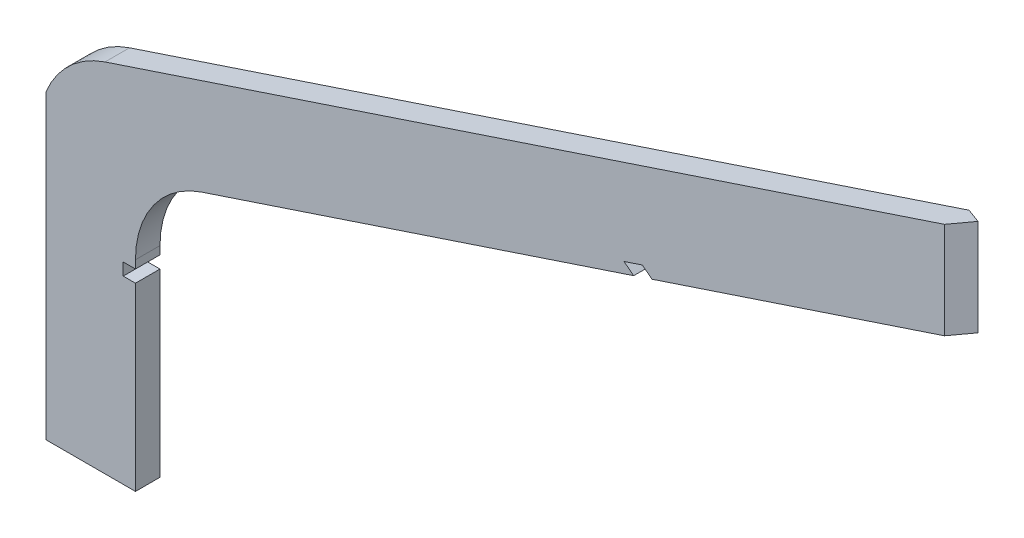
from build123d import *

# Parameters (mm, degrees)
BOSS_EXTRUDE1_DEPTH      = 3.175
BOSS_EXTRUDE1_DEPTH_BACK = 3.175
CUT_EXTRUDE3_DEPTH       = 206.528461822
CUT_EXTRUDE5_DEPTH       = 206.528461822
CUT_EXTRUDE6_DEPTH       = 6.35
SKETCH8_W                = 3.175
SKETCH8_H                = 3.175
CUT_EXTRUDE7_DEPTH       = 6.35


with BuildPart() as part:
    # Sketch1 → Boss-Extrude1 (new, two sides: drawn at the far end of the back side and taken through both)
    with BuildSketch(Plane.XY.offset(-BOSS_EXTRUDE1_DEPTH_BACK)):
        with BuildLine():
            Line((-95.480291898, -80.706386575), (-95.480291898, -131.085242165))
            Line((-95.480291898, -131.085242165), (-95.480291898, -132.672742165))
            Line((-95.480291898, -132.672742165), (-120.480291898, -132.672742165))
            Line((-120.480291898, -132.672742165), (-120.480291898, -131.085242165))
            Line((-120.480291898, -131.085242165), (-120.480291898, -64.018285781))
            ThreePointArc((-120.480291898, -64.018285781), (-115.755703828, -49.392703021), (-103.367678212, -40.295108567))
            Line((-103.367678212, -40.295108567), (119.519708102, 33.809591006))
            Line((119.519708102, 33.809591006), (119.519708102, 8.809591006))
            Line((119.519708102, 8.809591006), (-78.367678212, -56.983209361))
            ThreePointArc((-78.367678212, -56.983209361), (-90.755703828, -66.080803815), (-95.480291898, -80.706386575))
        make_face()
    extrude(amount=BOSS_EXTRUDE1_DEPTH + BOSS_EXTRUDE1_DEPTH_BACK)

    # Sketch2 → Cut-Extrude3 (cut, through all)
    with BuildSketch(Plane.XZ.offset(132.672742165)):
        Polygon((-120.480291898, 0), (-120.480291898, 3.175), (-118.647204793, 3.175), align=None)
    cut_extrude3 = extrude(amount=-CUT_EXTRUDE3_DEPTH, mode=Mode.SUBTRACT)

    # Mirror3: Cut-Extrude3 across plane
    add(cut_extrude3.mirror(Plane.XY), mode=Mode.SUBTRACT)

    # Sketch3 → Cut-Extrude5 (cut, through all)
    with BuildSketch(Plane.XZ.offset(132.672742165)):
        Polygon((119.519708102, 3.175), (114.020446788, 3.175), (119.519708102, 0), align=None)
    cut_extrude5 = extrude(amount=-CUT_EXTRUDE5_DEPTH, mode=Mode.SUBTRACT)

    # Mirror4: Cut-Extrude5 across plane
    add(cut_extrude5.mirror(Plane.XY), mode=Mode.SUBTRACT)

    # Sketch6 → Cut-Extrude6 (cut)
    with BuildSketch(Plane.XY.offset(3.175)):
        Polygon((33.546459297, -19.774448133), (38.29109474, -18.19697087), (35.769730347, -16.267373348), (31.025094904, -17.844850611), align=None)
    extrude(amount=-CUT_EXTRUDE6_DEPTH, mode=Mode.SUBTRACT)

    # Sketch8 → Cut-Extrude7 (cut)
    with BuildSketch(Plane.XY.offset(3.175)):
        with Locations((-97.067791898, -84.378992165)):
            Rectangle(SKETCH8_W, SKETCH8_H)
    extrude(amount=-CUT_EXTRUDE7_DEPTH, mode=Mode.SUBTRACT)


solid = part.part
